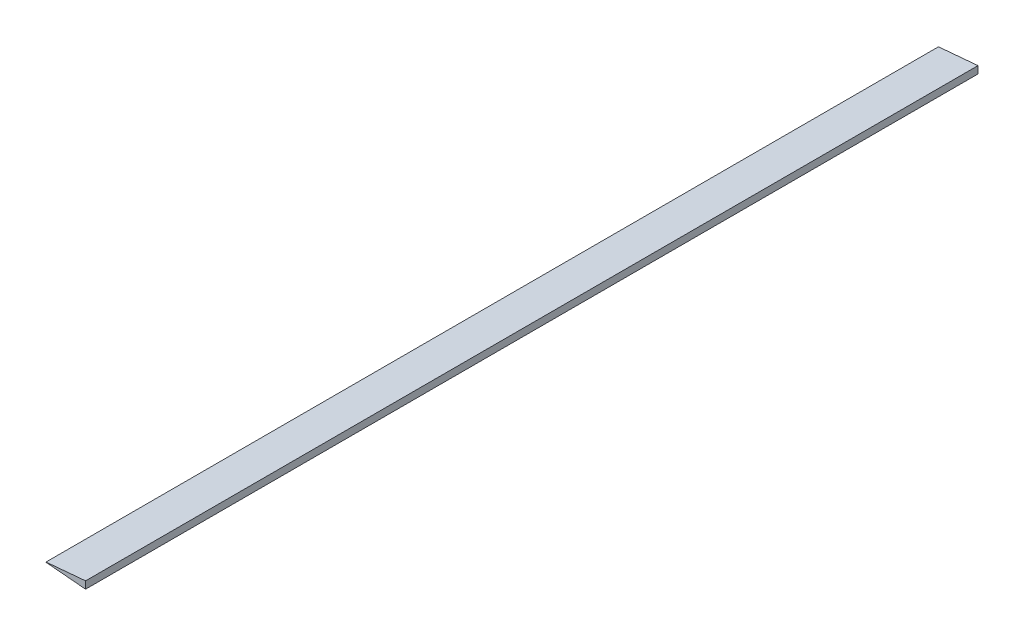
from build123d import *

# Parameters (mm, degrees)
BOSS_EXTRUDE1_DEPTH = 422.9


with BuildPart() as part:
    # Sketch1 → Boss-Extrude1 (new, symmetric)
    with BuildSketch(Plane.XY):
        with BuildLine():
            Line((-87.514, 3.434440277), (-87.514, -3.434440277))
            add(Edge.make_bspline(
                [(-87.514, -3.434440277), (-87.654370744, -3.424535645), (-89.738768034, -3.277459503), (-93.651714929, -2.974429583), (-99.119216256, -2.537921339), (-104.185410687, -2.109314547), (-108.795049029, -1.701875709), (-112.897560329, -1.324090468), (-116.448011673, -0.985258043), (-119.407505812, -0.693967655), (-121.743630756, -0.458114732), (-123.430801146, -0.284382732), (-124.450552292, -0.178005142), (-124.905855357, -0.130142965), (-125.02, -0.1181439)],
                knots=[0, 0, 0, 0, 0.011211572, 0.166483201, 0.31268616, 0.448210553, 0.571562716, 0.681381362, 0.776452467, 0.855722863, 0.918312437, 0.963524724, 0.990855635, 1, 1, 1, 1], degree=3))
            Line((-125.02, -0.1181439), (-125.02, 0.1181439))
            add(Edge.make_bspline(
                [(-87.514, 3.434440277), (-87.654370744, 3.424535645), (-89.738768034, 3.277459503), (-93.651714929, 2.974429583), (-99.119216256, 2.537921339), (-104.185410687, 2.109314547), (-108.795049029, 1.701875709), (-112.897560329, 1.324090468), (-116.448011673, 0.985258043), (-119.407505812, 0.693967655), (-121.743630756, 0.458114732), (-123.430801146, 0.284382732), (-124.450552292, 0.178005142), (-124.905855357, 0.130142965), (-125.02, 0.1181439)],
                knots=[0, 0, 0, 0, 0.011211572, 0.166483201, 0.31268616, 0.448210553, 0.571562716, 0.681381362, 0.776452467, 0.855722863, 0.918312437, 0.963524724, 0.990855635, 1, 1, 1, 1], degree=3))
        make_face()
    extrude(amount=BOSS_EXTRUDE1_DEPTH, both=True)


solid = part.part
